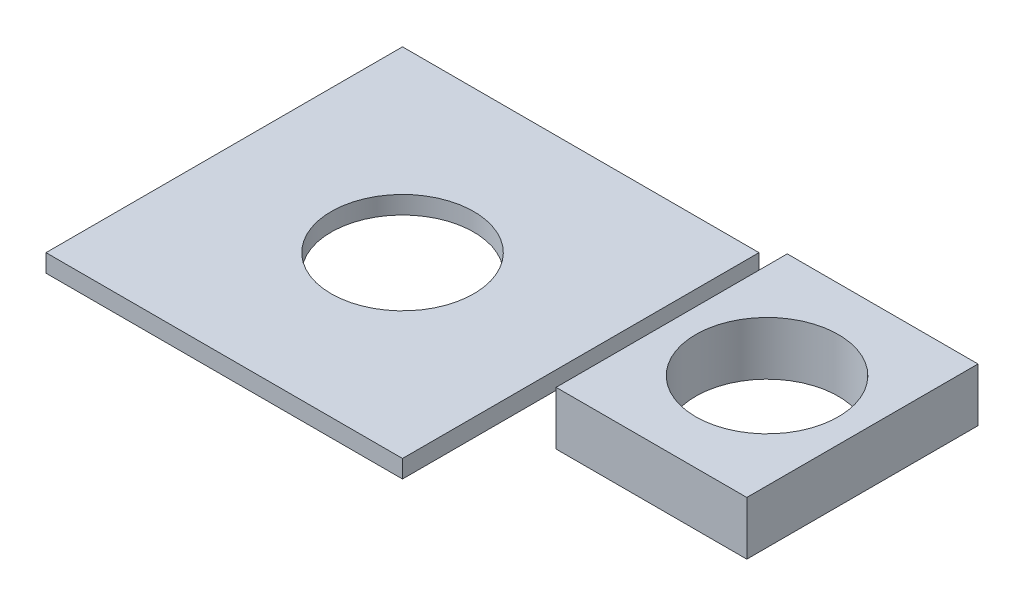
from build123d import *

# Parameters (mm, degrees)
SKETCH1_W           = 10.7
SKETCH1_H           = 12.97
SKETCH1_R           = 4
BOSS_EXTRUDE1_DEPTH = 3
SKETCH2_W           = 20
SKETCH2_H           = 20
SKETCH2_R           = 4
BOSS_EXTRUDE2_DEPTH = 1


with BuildPart() as part:
    # Sketch1 → Boss-Extrude1 (new body)
    with BuildSketch(Plane(origin=(0, 0, 0), x_dir=(1, 0, 0), z_dir=(0, 1, 0))):
        Rectangle(SKETCH1_W, SKETCH1_H)
        with Locations(Location((0, 0, 0), (0, 0, 270))):
            Circle(SKETCH1_R, mode=Mode.SUBTRACT)
    extrude(amount=BOSS_EXTRUDE1_DEPTH)


with BuildPart() as body_2:
    # Sketch2 → Boss-Extrude2 (new body)
    with BuildSketch(Plane(origin=(0, 0, 0), x_dir=(1, 0, 0), z_dir=(0, 1, 0))):
        with Locations((-18.201727798, -2.249298379)):
            Rectangle(SKETCH2_W, SKETCH2_H)
        with Locations(Location((-18.201727798, -2.249298379, 0), (0, 0, 270))):
            Circle(SKETCH2_R, mode=Mode.SUBTRACT)
    extrude(amount=BOSS_EXTRUDE2_DEPTH)


solid = Compound([part.part, body_2.part])
